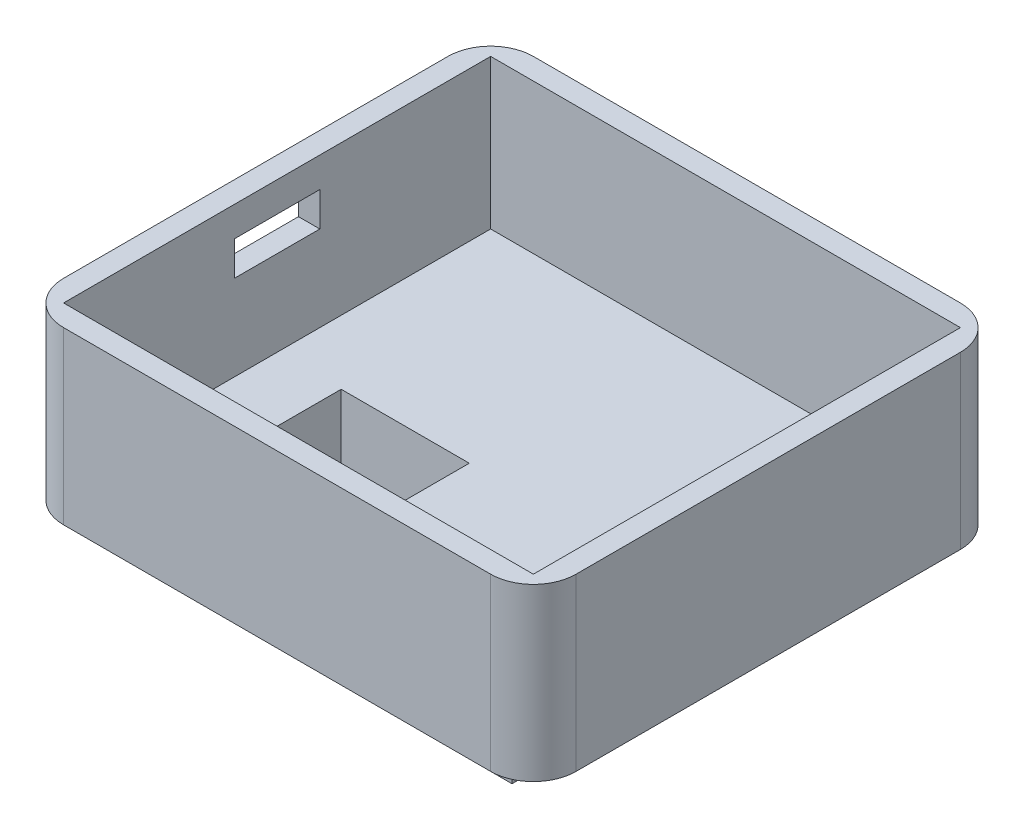
from build123d import *

# Parameters (mm, degrees)
SKETCH5_W           = 60
SKETCH5_H           = 55
BOSS_EXTRUDE4_DEPTH = 20
SKETCH6_W           = 55
SKETCH6_H           = 50
CUT_EXTRUDE2_DEPTH  = 17.5
FILLET1_R           = 5
SKETCH8_W           = 45
SKETCH8_H           = 45
BOSS_EXTRUDE5_DEPTH = 5
CUT_EXTRUDE4_REACH  = 49.762
SKETCH9_W           = 15
SKETCH9_H           = 20
CUT_EXTRUDE5_REACH  = 68.802
SKETCH11_W          = 10
SKETCH11_H          = 4


with BuildPart() as part:
    # Sketch5 → Boss-Extrude4 (new body)
    with BuildSketch(Plane(origin=(0, 0, 0), x_dir=(1, 0, 0), z_dir=(0, 1, 0))):
        Rectangle(SKETCH5_W, SKETCH5_H)
    extrude(amount=BOSS_EXTRUDE4_DEPTH)

    # Sketch6 → Cut-Extrude2 (cut)
    with BuildSketch(Plane(origin=(0, 20, 0), x_dir=(1, 0, 0), z_dir=(0, 1, 0))):
        Rectangle(SKETCH6_W, SKETCH6_H)
    extrude(amount=-CUT_EXTRUDE2_DEPTH, mode=Mode.SUBTRACT)

    # Fillet1
    fillet1_edges = [part.edges().sort_by_distance(p)[0] for p in [
        (-30, 10, -27.5),
        (30, 10, -27.5),
        (30, 10, 27.5),
        (-30, 10, 27.5),
    ]]
    fillet(fillet1_edges, radius=FILLET1_R)

    # Sketch8 → Boss-Extrude5 (add)
    with BuildSketch(Plane.XZ):
        Rectangle(SKETCH8_W, SKETCH8_H)
    extrude(amount=BOSS_EXTRUDE5_DEPTH)

    # Sketch9 → Cut-Extrude4 (cut, up to next)
    with BuildSketch(Plane.XZ.offset(5), mode=Mode.PRIVATE) as cut_extrude4_sk1:
        with Locations((-12.5, 10)):
            Rectangle(SKETCH9_W, SKETCH9_H)
    cut_extrude4_tool1 = extrude(cut_extrude4_sk1.sketch, amount=-CUT_EXTRUDE4_REACH, mode=Mode.PRIVATE) & part.part
    add(cut_extrude4_tool1.solids().sort_by_distance((-12.5, -5, 10))[0], mode=Mode.SUBTRACT)

    # Sketch11 → Cut-Extrude5 (cut, up to next)
    with BuildSketch(Plane(origin=(-27.5, 0, 0), x_dir=(0, 0, -1), z_dir=(1, 0, 0)), mode=Mode.PRIVATE) as cut_extrude5_sk1:
        with Locations((0, 14.5)):
            Rectangle(SKETCH11_W, SKETCH11_H)
    cut_extrude5_tool1 = extrude(cut_extrude5_sk1.sketch, amount=-CUT_EXTRUDE5_REACH, mode=Mode.PRIVATE) & part.part
    add(cut_extrude5_tool1.solids().sort_by_distance((-27.5, 14.5, 0))[0], mode=Mode.SUBTRACT)


solid = part.part
